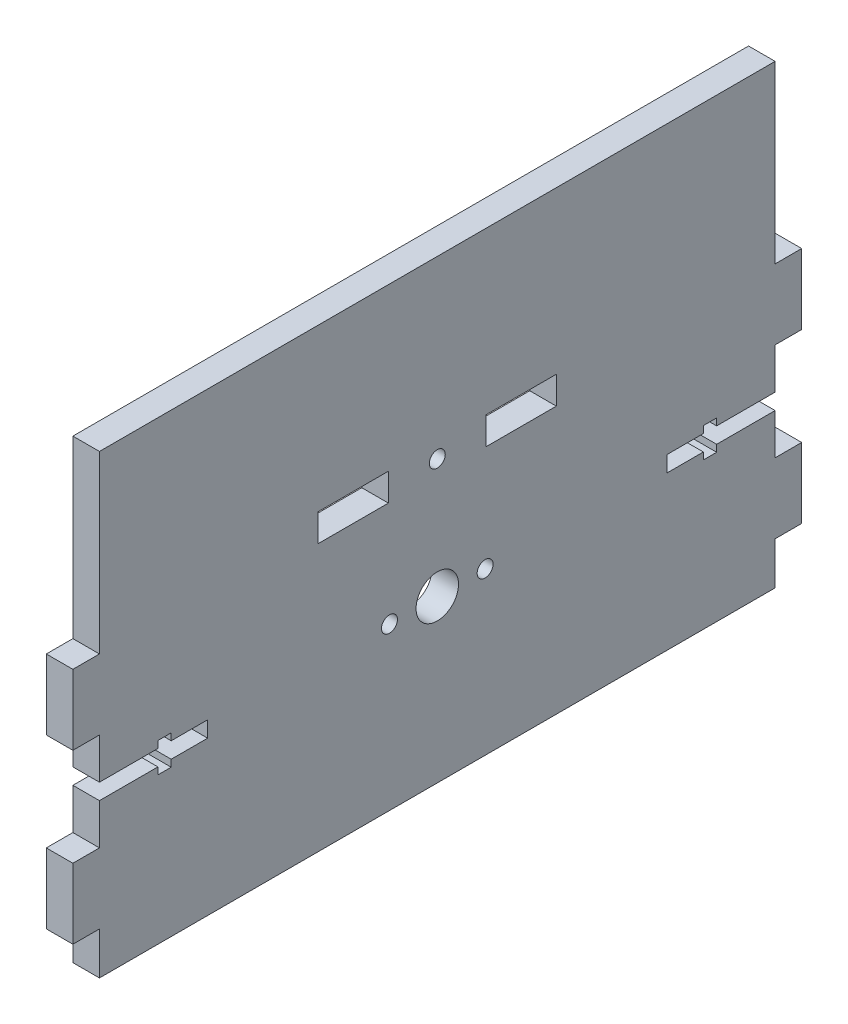
from build123d import *

# Parameters (mm, degrees)
SKETCH1_R           = 4
SKETCH1_R_2         = 1.5
SKETCH1_W           = 13.2
SKETCH1_H           = 5.2
BOSS_EXTRUDE1_DEPTH = 5


with BuildPart() as part:
    # Sketch1 → Boss-Extrude1 (new body)
    with BuildSketch(Plane(origin=(0, 0, 0), x_dir=(0, 0, -1), z_dir=(1, 0, 0))):
        Polygon((-135.781354304, 106.733539226), (-135.781354304, 139.733539226), (-8.651354304, 139.733539226), (-8.651354304, 106.733539226), (-3.651354304, 106.733539226), (-3.651354304, 93.533539226), (-8.651354304, 93.533539226), (-8.651354304, 85.833539226), (-19.651354304, 85.833539226), (-19.651354304, 87.133539226), (-22.151354304, 87.133539226), (-22.151354304, 85.833539226), (-29.008589557, 85.833539226), (-29.008589557, 82.833539226), (-22.151354304, 82.833539226), (-22.151354304, 81.533539226), (-19.651354304, 81.533539226), (-19.651354304, 82.833539226), (-8.651354304, 82.833539226), (-8.651354304, 75.133539226), (-3.651354304, 75.133539226), (-3.651354304, 61.933539226), (-8.651354304, 61.933539226), (-8.651354304, 53.933539226), (-135.781354304, 53.933539226), (-135.781354304, 61.933539226), (-140.781354304, 61.933539226), (-140.781354304, 75.133539226), (-135.781354304, 75.133539226), (-135.781354304, 82.833539226), (-124.781354304, 82.833539226), (-124.781354304, 81.533539226), (-122.281354304, 81.533539226), (-122.281354304, 82.833539226), (-115.424119051, 82.833539226), (-115.424119051, 85.833539226), (-122.281354304, 85.833539226), (-122.281354304, 87.133539226), (-124.781354304, 87.133539226), (-124.781354304, 85.833539226), (-135.781354304, 85.833539226), (-135.781354304, 93.533539226), (-140.781354304, 93.533539226), (-140.781354304, 106.733539226), align=None)
        with Locations((-72.216354304, 84.333539226)):
            Circle(SKETCH1_R, mode=Mode.SUBTRACT)
        with Locations((-81.216354304, 84.333539226)):
            Circle(SKETCH1_R_2, mode=Mode.SUBTRACT)
        with Locations((-63.216354304, 84.333539226)):
            Circle(SKETCH1_R_2, mode=Mode.SUBTRACT)
        with Locations((-72.216354304, 106.733539226)):
            Circle(SKETCH1_R_2, mode=Mode.SUBTRACT)
        with Locations((-56.416354304, 106.733539226)):
            Rectangle(SKETCH1_W, SKETCH1_H, mode=Mode.SUBTRACT)
        with Locations((-88.016354304, 106.733539226)):
            Rectangle(SKETCH1_W, SKETCH1_H, mode=Mode.SUBTRACT)
    extrude(amount=BOSS_EXTRUDE1_DEPTH)


solid = part.part
